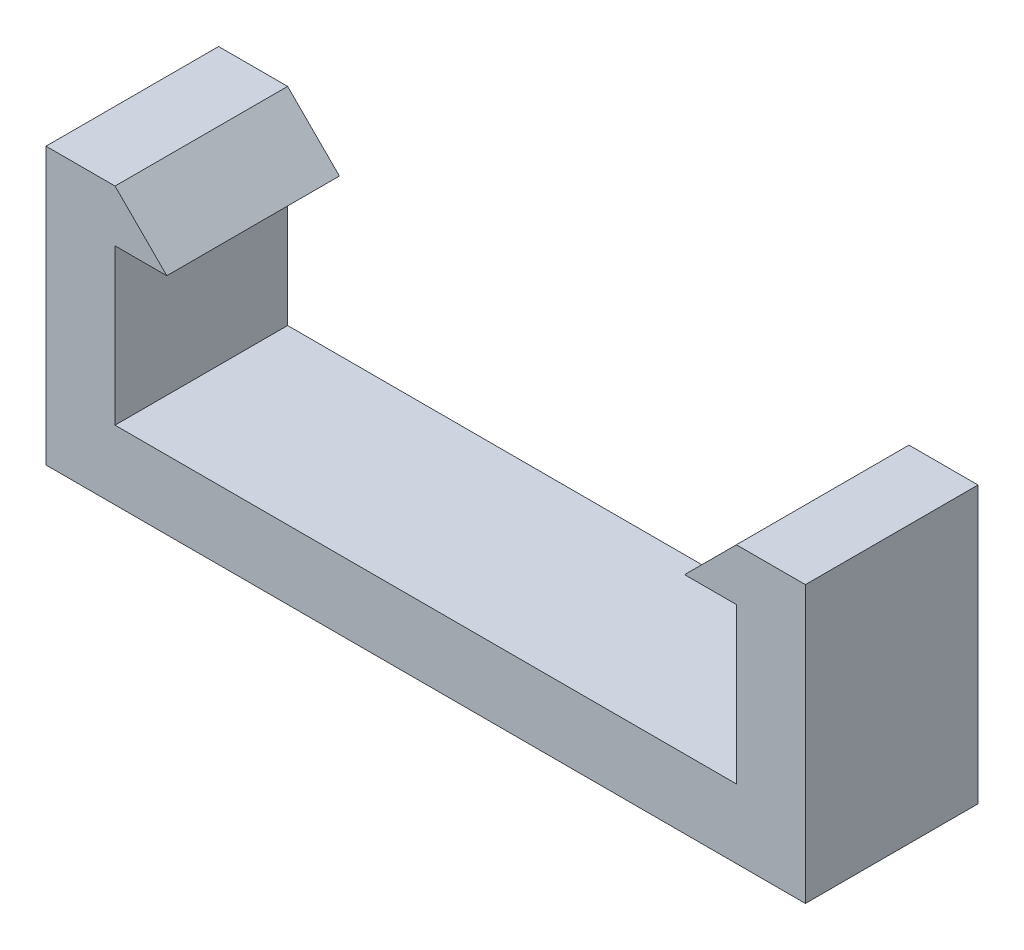
from build123d import *

# Parameters (mm, degrees)
BOSS_EXTRUDE1_DEPTH = 5


with BuildPart() as part:
    # Sketch1 → Boss-Extrude1 (new body)
    with BuildSketch(Plane.XY):
        Polygon((0, 0), (0, -8), (22, -8), (22, 0), (20, 0), (18.5, -1.5), (20, -1.5), (20, -6), (2, -6), (2, -1.5), (3.5, -1.5), (2, 0), align=None)
    extrude(amount=BOSS_EXTRUDE1_DEPTH)


solid = part.part
